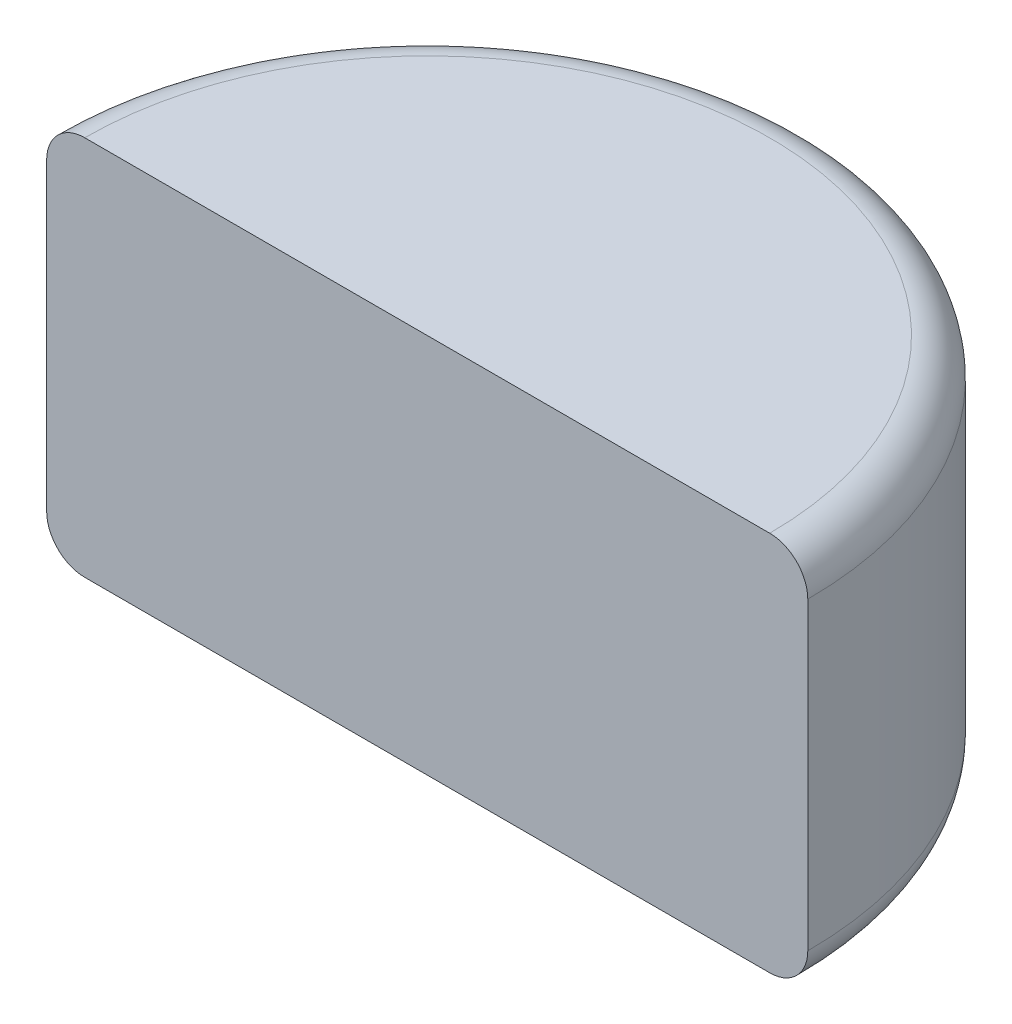
from build123d import *

# Parameters (mm, degrees)
BOSS_EXTRUDE1_DEPTH = 25.4
FILLET1_R           = 2.54


with BuildPart() as part:
    # Sketch1 → Boss-Extrude1 (new body)
    with BuildSketch(Plane(origin=(0, 0, 0), x_dir=(1, 0, 0), z_dir=(0, 1, 0))):
        with BuildLine():
            Line((0, 0), (50.778548057, 0))
            ThreePointArc((50.778548057, 0), (25.389274028, 25.389274028), (0, 0))
        make_face()
    extrude(amount=BOSS_EXTRUDE1_DEPTH)

    # Fillet1
    fillet1_edges = [part.edges().sort_by_distance(p)[0] for p in [
        (25.389274028, 0, -25.389274028),
        (25.389274028, 25.4, -25.389274028),
    ]]
    fillet(fillet1_edges, radius=FILLET1_R)


solid = part.part
